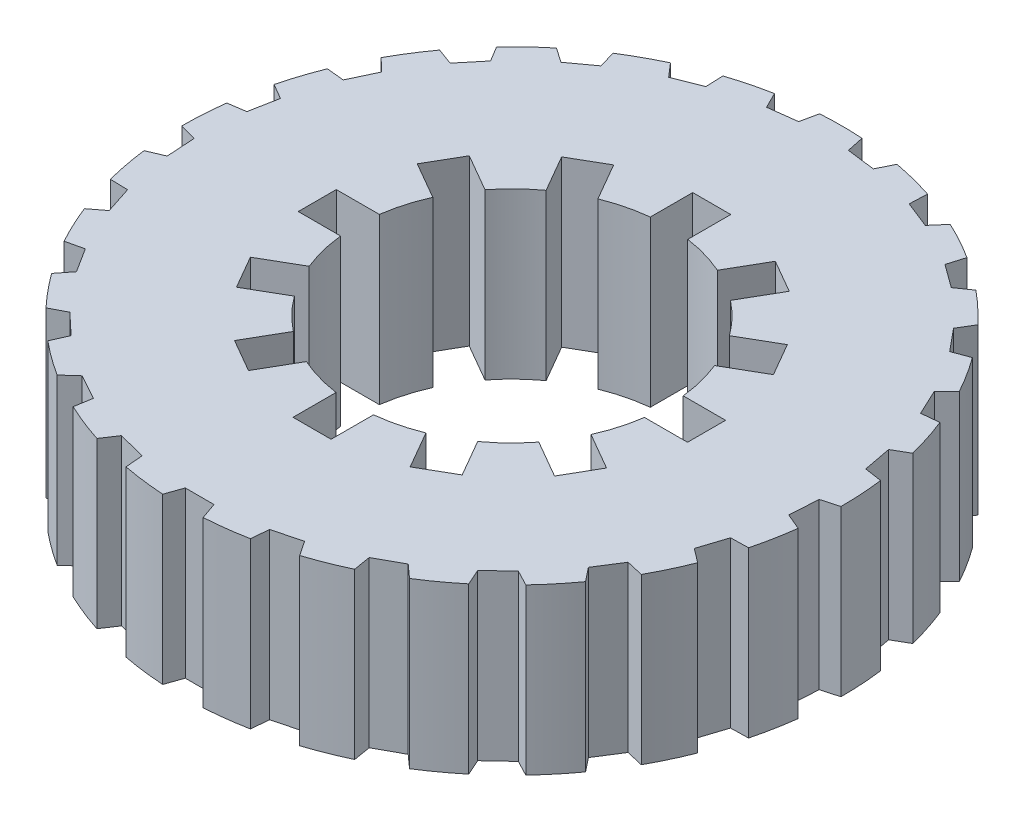
from build123d import *

# Parameters (mm, degrees)
SKETCH1_R           = 38.1
BOSS_EXTRUDE1_DEPTH = 19.05
CUT_EXTRUDE1_DEPTH  = 33
CIRPATTERN1_COUNT   = 25
CUT_EXTRUDE2_DEPTH  = 28
CUT_EXTRUDE8_DEPTH  = 23
CIRPATTERN2_COUNT   = 12


with BuildPart() as part:
    # Sketch1 → Boss-Extrude1 (new body)
    with BuildSketch(Plane(origin=(0, 0, 0), x_dir=(1, 0, 0), z_dir=(0, 1, 0))):
        Circle(SKETCH1_R)
    extrude(amount=BOSS_EXTRUDE1_DEPTH)

    # Sketch2 → Cut-Extrude1 (cut)
    with BuildSketch(Plane.XZ):
        Polygon((0, 38.1), (-2.36, 38.1), (-1.66, 36.1), (0, 36.1), (1.66, 36.1), (2.36, 38.1), align=None)
    cut_extrude1 = extrude(amount=-CUT_EXTRUDE1_DEPTH, mode=Mode.SUBTRACT)

    # CirPattern1: Cut-Extrude1 ×25 about axis
    cirpattern1_axis = Axis((0, 0, 0), (0, 1, 0))
    for i in range(1, CIRPATTERN1_COUNT):
        add(cut_extrude1.rotate(cirpattern1_axis, i * 360 / CIRPATTERN1_COUNT), mode=Mode.SUBTRACT)

    # Sketch3 → Cut-Extrude2 (cut)
    with BuildSketch(Plane(origin=(0, 19.05, 0), x_dir=(1, 0, 0), z_dir=(0, 1, 0))):
        with BuildLine():
            ThreePointArc((2.5, 17.82554347), (0.302266808, 17.997461898), (-1.9, 17.899441332))
            ThreePointArc((-1.9, 17.899441332), (-12.037441589, -13.382824814), (18, 0))
            ThreePointArc((18, 0), (13.583077707, 11.811011811), (2.5, 17.82554347))
        make_face()
    extrude(amount=-CUT_EXTRUDE2_DEPTH, mode=Mode.SUBTRACT)

    # Sketch3<7> → Cut-Extrude8 (cut)
    with BuildSketch(Plane(origin=(0, 19.05, 0), x_dir=(1, 0, 0), z_dir=(0, 1, 0))):
        with BuildLine():
            Line((0.3, 22.8), (-1.9, 22.8))
            Line((-1.9, 22.8), (-1.9, 17.899441332))
            ThreePointArc((-1.9, 17.899441332), (0.302266808, 17.997461898), (2.5, 17.82554347))
            Line((2.5, 17.82554347), (2.5, 22.8))
            Line((2.5, 22.8), (0.3, 22.8))
        make_face()
    cut_extrude8 = extrude(amount=-CUT_EXTRUDE8_DEPTH, mode=Mode.SUBTRACT)

    # CirPattern2: Cut-Extrude8 ×12 about axis
    cirpattern2_axis = Axis((0, 19.05, 0), (0, 1, 0))
    for i in range(1, CIRPATTERN2_COUNT):
        add(cut_extrude8.rotate(cirpattern2_axis, i * 360 / CIRPATTERN2_COUNT), mode=Mode.SUBTRACT)


solid = part.part
